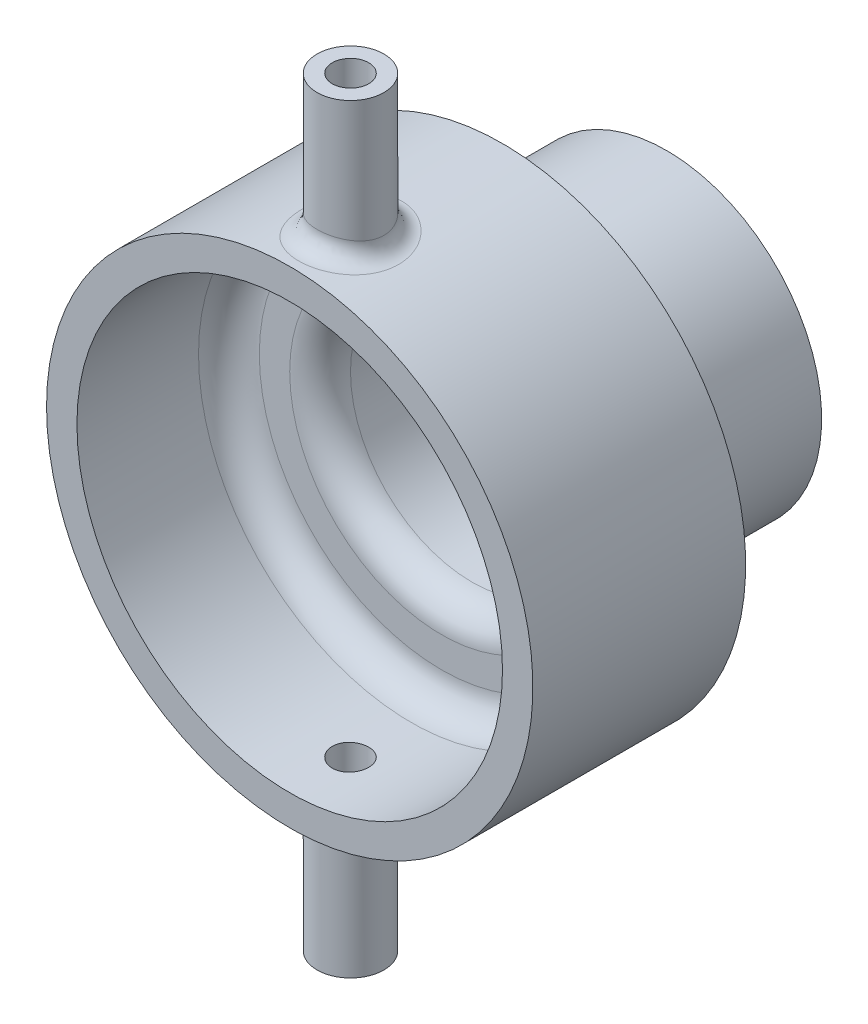
from build123d import *

# Parameters (mm, degrees)
CHAMFER1_SIZE       = 10
SKETCH2_R           = 1.25
CUT_EXTRUDE1_DEPTH  = 30
SKETCH5_R           = 5.5
BOSS_EXTRUDE1_DEPTH = 62.5
SKETCH3_R           = 35
CUT_EXTRUDE2_DEPTH  = 25
SKETCH4_R           = 20
CUT_EXTRUDE3_DEPTH  = 32
FILLET1_R           = 5
FILLET2_R           = 3
SKETCH6_R           = 3
CUT_EXTRUDE4_DEPTH  = 146.151644955


with BuildPart() as part:
    # Sketch1 → Revolve1 (revolve)
    with BuildSketch(Plane(origin=(0, 0, 0), x_dir=(1, 0, 0), z_dir=(0, 1, 0)), mode=Mode.PRIVATE) as revolve1_sk:
        Polygon((0, 0), (40, 0), (40, 35), (25.5, 35), (25.5, 62), (0, 62), align=None)
    revolve(revolve1_sk.sketch.rotate(Axis((0, 0, -62), (0, 0, 1)), 180), axis=Axis((0, 0, -62), (0, 0, 1)))

    # Chamfer1
    chamfer1_edges = [part.edges().sort_by_distance(p)[0] for p in [
        (25.5, 0, -35),
    ]]
    chamfer(chamfer1_edges, length=CHAMFER1_SIZE)

    # Sketch2 → Cut-Extrude1 (cut)
    with BuildSketch(Plane(origin=(0, 0, -62), x_dir=(-1, 0, 0), z_dir=(0, 0, -1))):
        Circle(SKETCH2_R)
    extrude(amount=-CUT_EXTRUDE1_DEPTH, mode=Mode.SUBTRACT)

    # Sketch5 → Boss-Extrude1 (add, symmetric)
    with BuildSketch(Plane(origin=(0, 0, 0), x_dir=(1, 0, 0), z_dir=(0, 1, 0))):
        with Locations(Location((0, 10, 0), (0, 0, 90))):
            Circle(SKETCH5_R)
    extrude(amount=BOSS_EXTRUDE1_DEPTH, both=True)

    # Sketch3 → Cut-Extrude2 (cut)
    with BuildSketch(Plane.XY):
        Circle(SKETCH3_R)
    extrude(amount=-CUT_EXTRUDE2_DEPTH, mode=Mode.SUBTRACT)

    # Sketch4 → Cut-Extrude3 (cut)
    with BuildSketch(Plane.XY.offset(-25)):
        Circle(SKETCH4_R)
    extrude(amount=-CUT_EXTRUDE3_DEPTH, mode=Mode.SUBTRACT)

    # Fillet1
    fillet1_edges = [part.edges().sort_by_distance(p)[0] for p in [
        (-35, 0, -25),
        (-20, 0, -57),
        (-20, 0, -25),
    ]]
    fillet(fillet1_edges, radius=FILLET1_R)

    # Fillet2
    fillet2_edges = [part.edges().sort_by_distance(p)[0] for p in [
        (0, -40, -4.5),
        (0, 40, -4.5),
    ]]
    fillet(fillet2_edges, radius=FILLET2_R)

    # Sketch6 → Cut-Extrude4 (cut, through all)
    with BuildSketch(Plane(origin=(0, 62.5, 0), x_dir=(1, 0, 0), z_dir=(0, 1, 0))):
        with Locations(Location((0, 10, 0), (0, 0, 270))):
            Circle(SKETCH6_R)
    extrude(amount=-CUT_EXTRUDE4_DEPTH, mode=Mode.SUBTRACT)


solid = part.part
